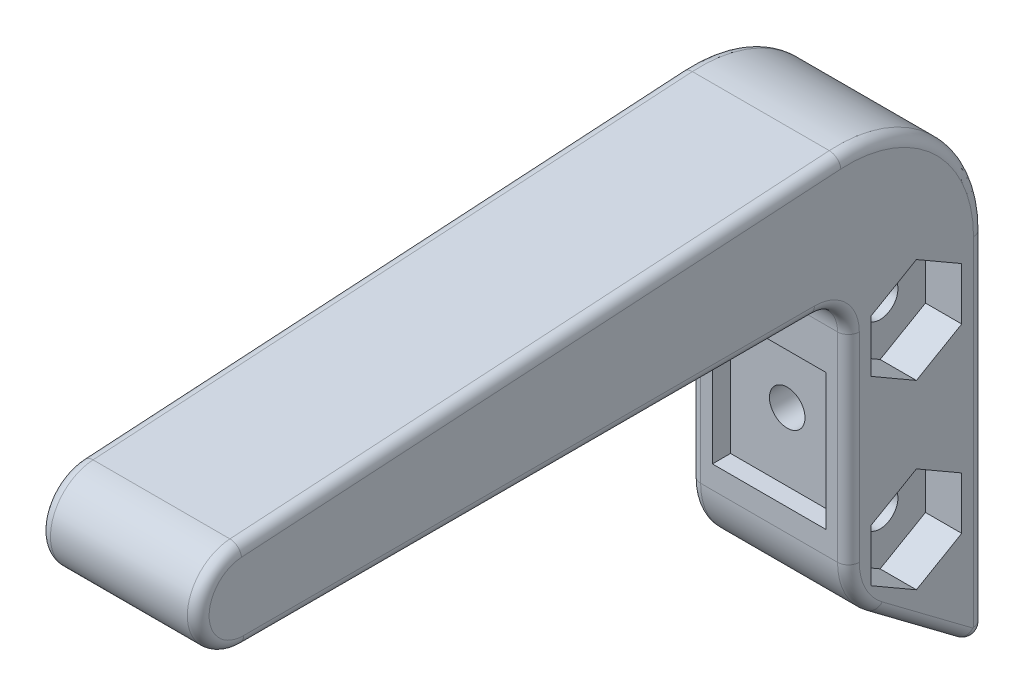
from build123d import *

# Parameters (mm, degrees)
SKETCH1_R           = 2.4892
BOSS_EXTRUDE1_DEPTH = 11.1125
FILLET1_R           = 1.5875
CUT_EXTRUDE1_DEPTH  = 5.08
SKETCH4_W           = 15.875
SKETCH4_H           = 19.05
CUT_EXTRUDE2_DEPTH  = 2.54
SKETCH5_R           = 2.4892
CUT_EXTRUDE3_DEPTH  = 104.567416874
FILLET2_R           = 1.524
CUT_EXTRUDE4_DEPTH  = 4.7625


with BuildPart() as part:
    # Sketch1 → Boss-Extrude1 (new, symmetric)
    with BuildSketch(Plane(origin=(0, 0, 0), x_dir=(0, 0, -1), z_dir=(1, 0, 0))):
        with BuildLine():
            Line((-9.525, 2.5527), (-9.525, -25.4))
            ThreePointArc((-9.525, -25.4), (-8.519418994, -29.659709497), (-5.715, -33.02))
            Line((-5.715, -33.02), (9.525, -44.45))
            Line((9.525, -44.45), (9.525, 6.116314701))
            ThreePointArc((9.525, 6.116314701), (3.528372392, 19.99118296), (-10.686230362, 25.130889218))
            Line((-10.686230362, 25.130889218), (-94.646476787, 20.003391506))
            ThreePointArc((-94.646476787, 20.003391506), (-100.60644719, 13.471571567), (-94.2594, 7.3152))
            Line((-94.2594, 7.3152), (-14.2875, 7.3152))
            ThreePointArc((-14.2875, 7.3152), (-10.919903955, 5.920296045), (-9.525, 2.5527))
        make_face()
        Circle(SKETCH1_R, mode=Mode.SUBTRACT)
        with Locations((0, -25.4)):
            Circle(SKETCH1_R, mode=Mode.SUBTRACT)
    extrude(amount=BOSS_EXTRUDE1_DEPTH, both=True)

    # Fillet1
    fillet1_edges = [part.edges().sort_by_distance(p)[0] for p in [
        (0, -44.45, -9.525),
    ]]
    fillet(fillet1_edges, radius=FILLET1_R)

    # Sketch3 → Cut-Extrude1 (cut)
    with BuildSketch(Plane.ZY.offset(11.1125)):
        Polygon((0, 7.332348419), (-6.35, 3.666174209), (-6.35, -3.666174209), (0, -7.332348419), (6.35, -3.666174209), (6.35, 3.666174209), align=None)
        Polygon((0, -18.067651581), (-6.35, -21.733825791), (-6.35, -29.066174209), (0, -32.732348419), (6.35, -29.066174209), (6.35, -21.733825791), align=None)
    cut_extrude1 = extrude(amount=-CUT_EXTRUDE1_DEPTH, mode=Mode.SUBTRACT)

    # Mirror1: Cut-Extrude1 across plane
    add(cut_extrude1.mirror(Plane(origin=(0, 0, 0), x_dir=(0, 0, 1), z_dir=(1, 0, 0))), mode=Mode.SUBTRACT)

    # Sketch4 → Cut-Extrude2 (cut)
    with BuildSketch(Plane.XY.offset(9.525)):
        with Locations((0, -12.7)):
            Rectangle(SKETCH4_W, SKETCH4_H)
    extrude(amount=-CUT_EXTRUDE2_DEPTH, mode=Mode.SUBTRACT)

    # Sketch5 → Cut-Extrude3 (cut, through all)
    with BuildSketch(Plane.XY.offset(6.985)):
        with Locations((0, -12.7)):
            Circle(SKETCH5_R)
    extrude(amount=-CUT_EXTRUDE3_DEPTH, mode=Mode.SUBTRACT)

    # Fillet2
    fillet2_edges = [part.edges().sort_by_distance(p)[0] for p in [
        (-11.1125, -11.42365, 9.525),
        (-11.1125, 5.920296045, 10.919903955),
        (-11.1125, 7.3152, 54.27345),
        (-11.1125, 13.471571567, 100.60644719),
        (-11.1125, 22.567140362, 52.666353575),
        (-11.1125, 19.99118296, -3.528372392),
        (-11.1125, -17.579342649, -9.525),
        (-11.1125, -42.694903166, -8.647451583),
        (-11.1125, -37.7825, -0.635),
        (11.1125, 13.471571567, 100.60644719),
        (11.1125, 22.567140362, 52.666353575),
        (11.1125, 19.99118296, -3.528372392),
        (11.1125, -17.579342649, -9.525),
        (11.1125, -42.694903166, -8.647451583),
        (11.1125, -37.7825, -0.635),
        (11.1125, -29.659709497, 8.519418994),
        (11.1125, -11.42365, 9.525),
        (11.1125, 5.920296045, 10.919903955),
        (-11.1125, -29.659709497, 8.519418994),
        (11.1125, 7.3152, 54.27345),
    ]]
    fillet(fillet2_edges, radius=FILLET2_R)

    # Sketch6 → Cut-Extrude4 (cut)
    with BuildSketch(Plane(origin=(0, 0, -9.525), x_dir=(-1, 0, 0), z_dir=(0, 0, -1))):
        Polygon((0, -18.199261314), (4.7625, -15.449630657), (4.7625, -9.950369343), (0, -7.200738686), (-4.7625, -9.950369343), (-4.7625, -15.449630657), align=None)
    extrude(amount=-CUT_EXTRUDE4_DEPTH, mode=Mode.SUBTRACT)


solid = part.part
